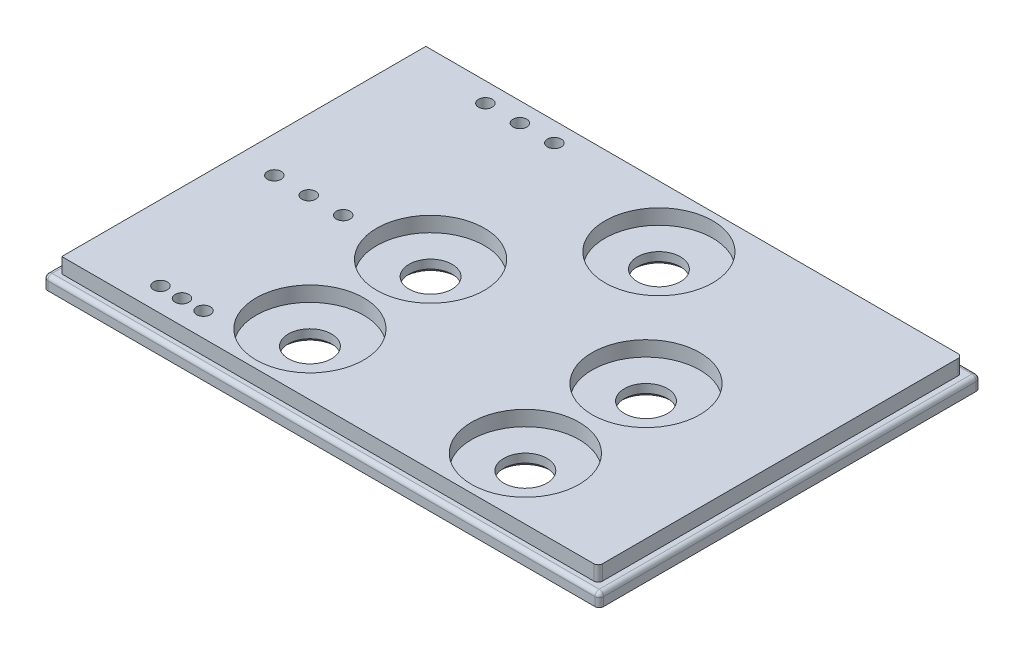
from build123d import *

# Parameters (mm, degrees)
SKETCH_1_W          = 129
SKETCH_1_H          = 88.5
EXTRUDE_1_DEPTH     = 3
SKETCH_2_R          = 5.00000016
CUT_EXTRUDE_1_DEPTH = 154.829654163
SKETCH_3_R          = 1.6
CUT_EXTRUDE_2_DEPTH = 154.829654163
CHAMFER_1_SIZE      = 1
CHAMFER_2_SIZE      = 1
SKETCH_6_W          = 124.5
SKETCH_6_H          = 84.5
EXTRUDE_3_DEPTH     = 3.5
SKETCH_7_R          = 5.00000016
SKETCH_7_R_2        = 1.6
CUT_EXTRUDE_3_DEPTH = 154.840217434
SKETCH_9_R          = 12.5
CUT_EXTRUDE_4_DEPTH = 3.5
FILLET_4_R          = 1
FILLET_5_R          = 1
FILLET_6_R          = 1


with BuildPart() as part:
    # Эскиз1 → Бобышка-Вытянуть1 (new body)
    with BuildSketch(Plane(origin=(0, 37.5, 0), x_dir=(1, 0, 0), z_dir=(0, 1, 0))):
        with Locations((62.5, 42.5)):
            Rectangle(SKETCH_1_W, SKETCH_1_H)
    extrude(amount=EXTRUDE_1_DEPTH)

    # Эскиз2 → Вырез-Вытянуть1 (cut, through all)
    with BuildSketch(Plane(origin=(0, 40.5, 0), x_dir=(1, 0, 0), z_dir=(0, 1, 0))):
        with Locations(Location((43.5999659, 14.50003568, 0), (0, 0, 270))):
            Circle(SKETCH_2_R)
        with Locations(Location((43.5999659, 42.50003556, 0), (0, 0, 270))):
            Circle(SKETCH_2_R)
        with Locations(Location((68.5999667, 70.50003544, 0), (0, 0, 270))):
            Circle(SKETCH_2_R)
        with Locations(Location((93.5999675, 42.50003556, 0), (0, 0, 270))):
            Circle(SKETCH_2_R)
        with Locations(Location((93.5999675, 14.50003568, 0), (0, 0, 270))):
            Circle(SKETCH_2_R)
    extrude(amount=-CUT_EXTRUDE_1_DEPTH, mode=Mode.SUBTRACT)

    # Эскиз3 → Вырез-Вытянуть2 (cut, through all)
    with BuildSketch(Plane(origin=(0, 40.5, 0), x_dir=(1, 0, 0), z_dir=(0, 1, 0))):
        with Locations(Location((34.59981372, 80.23011504, 0), (0, 0, 270))):
            Circle(SKETCH_3_R)
        with Locations(Location((26.6000126, 80.22990168, 0), (0, 0, 270))):
            Circle(SKETCH_3_R)
        with Locations(Location((18.5998381, 80.23011504, 0), (0, 0, 270))):
            Circle(SKETCH_3_R)
        with Locations(Location((8.59981492, 41.2301143, 0), (0, 0, 270))):
            Circle(SKETCH_3_R)
        with Locations(Location((16.59981416, 41.2300889, 0), (0, 0, 270))):
            Circle(SKETCH_3_R)
        with Locations(Location((24.60001152, 41.22987554, 0), (0, 0, 270))):
            Circle(SKETCH_3_R)
        with Locations(Location((17.59991376, 5.79999466, 0), (0, 0, 270))):
            Circle(SKETCH_3_R)
        with Locations(Location((22.59991392, 5.79999466, 0), (0, 0, 270))):
            Circle(SKETCH_3_R)
        with Locations(Location((27.59991408, 5.79999466, 0), (0, 0, 270))):
            Circle(SKETCH_3_R)
    extrude(amount=-CUT_EXTRUDE_2_DEPTH, mode=Mode.SUBTRACT)

    # Фаска1
    chamfer_1_edges = [part.edges().sort_by_distance(p)[0] for p in [
        (43.5999659, 37.5, -19.50003584),
        (43.5999659, 37.5, -47.50003572),
        (68.5999667, 37.5, -75.5000356),
        (93.5999675, 37.5, -47.50003572),
        (93.5999675, 37.5, -19.50003584),
    ]]
    chamfer(chamfer_1_edges, length=CHAMFER_1_SIZE)

    # Фаска2
    chamfer_2_edges = [part.edges().sort_by_distance(p)[0] for p in [
        (34.59981372, 37.5, -81.83011504),
        (26.6000126, 37.5, -81.82990168),
        (18.5998381, 37.5, -81.83011504),
        (8.59981492, 37.5, -42.8301143),
        (16.59981416, 37.5, -42.8300889),
        (24.60001152, 37.5, -42.82987554),
    ]]
    chamfer(chamfer_2_edges, length=CHAMFER_2_SIZE)

    # Эскиз6 → Бобышка-Вытянуть3 (add)
    with BuildSketch(Plane(origin=(0, 40.5, 0), x_dir=(1, 0, 0), z_dir=(0, 1, 0))):
        with Locations((62.5, 42.5)):
            Rectangle(SKETCH_6_W, SKETCH_6_H)
    extrude(amount=EXTRUDE_3_DEPTH)

    # Эскиз7 → Вырез-Вытянуть3 (cut, through all)
    with BuildSketch(Plane.XZ.offset(-40.5)):
        with Locations(Location((43.5999659, -42.50003556, 0), (0, 0, 90))):
            Circle(SKETCH_7_R)
        with Locations(Location((43.5999659, -14.50003568, 0), (0, 0, 90))):
            Circle(SKETCH_7_R)
        with Locations(Location((93.5999675, -14.50003568, 0), (0, 0, 90))):
            Circle(SKETCH_7_R)
        with Locations(Location((93.5999675, -42.50003556, 0), (0, 0, 90))):
            Circle(SKETCH_7_R)
        with Locations(Location((68.5999667, -70.50003544, 0), (0, 0, 90))):
            Circle(SKETCH_7_R)
        with Locations(Location((24.60001152, -41.22987554, 0), (0, 0, 90))):
            Circle(SKETCH_7_R_2)
        with Locations(Location((16.59981416, -41.2300889, 0), (0, 0, 90))):
            Circle(SKETCH_7_R_2)
        with Locations(Location((8.59981492, -41.2301143, 0), (0, 0, 90))):
            Circle(SKETCH_7_R_2)
        with Locations(Location((18.5998381, -80.23011504, 0), (0, 0, 90))):
            Circle(SKETCH_7_R_2)
        with Locations(Location((26.6000126, -80.22990168, 0), (0, 0, 90))):
            Circle(SKETCH_7_R_2)
        with Locations(Location((34.59981372, -80.23011504, 0), (0, 0, 90))):
            Circle(SKETCH_7_R_2)
        with Locations(Location((17.59991376, -5.79999466, 0), (0, 0, 90))):
            Circle(SKETCH_7_R_2)
        with Locations(Location((22.59991392, -5.79999466, 0), (0, 0, 90))):
            Circle(SKETCH_7_R_2)
        with Locations(Location((27.59991408, -5.79999466, 0), (0, 0, 90))):
            Circle(SKETCH_7_R_2)
    extrude(amount=-CUT_EXTRUDE_3_DEPTH, mode=Mode.SUBTRACT)

    # Эскиз9 → Вырез-Вытянуть4 (cut)
    with BuildSketch(Plane(origin=(0, 44, 0), x_dir=(1, 0, 0), z_dir=(0, 1, 0))):
        with Locations(Location((43.5999659, 14.50003568, 0), (0, 0, 270))):
            Circle(SKETCH_9_R)
        with Locations(Location((43.5999659, 42.50003556, 0), (0, 0, 270))):
            Circle(SKETCH_9_R)
        with Locations(Location((68.5999667, 70.50003544, 0), (0, 0, 270))):
            Circle(SKETCH_9_R)
        with Locations(Location((93.5999675, 42.50003556, 0), (0, 0, 270))):
            Circle(SKETCH_9_R)
        with Locations(Location((93.5999675, 14.50003568, 0), (0, 0, 270))):
            Circle(SKETCH_9_R)
    extrude(amount=-CUT_EXTRUDE_4_DEPTH, mode=Mode.SUBTRACT)

    # Скругление4
    fillet_4_edges = [part.edges().sort_by_distance(p)[0] for p in [
        (124.75, 42.25, -0.25),
        (124.75, 42.25, -84.75),
        (127, 39, 1.75),
        (127, 39, -86.75),
    ]]
    fillet(fillet_4_edges, radius=FILLET_4_R)

    # Скругление5
    fillet_5_edges = [part.edges().sort_by_distance(p)[0] for p in [
        (62, 40.5, 1.75),
        (127, 40.5, -42.5),
        (62, 40.5, -86.75),
        (126.707106781, 40.5, -86.457106781),
        (126.707106781, 40.5, 1.457106781),
    ]]
    fillet(fillet_5_edges, radius=FILLET_5_R)

    # Скругление6
    fillet_6_edges = [part.edges().sort_by_distance(p)[0] for p in [
        (-2, 40.5, -42.5),
        (-2, 38.5, 1.75),
        (-2, 38.5, -86.75),
        (-2, 40.207106781, -86.457106781),
        (-2, 40.207106781, 1.457106781),
    ]]
    fillet(fillet_6_edges, radius=FILLET_6_R)


solid = part.part
